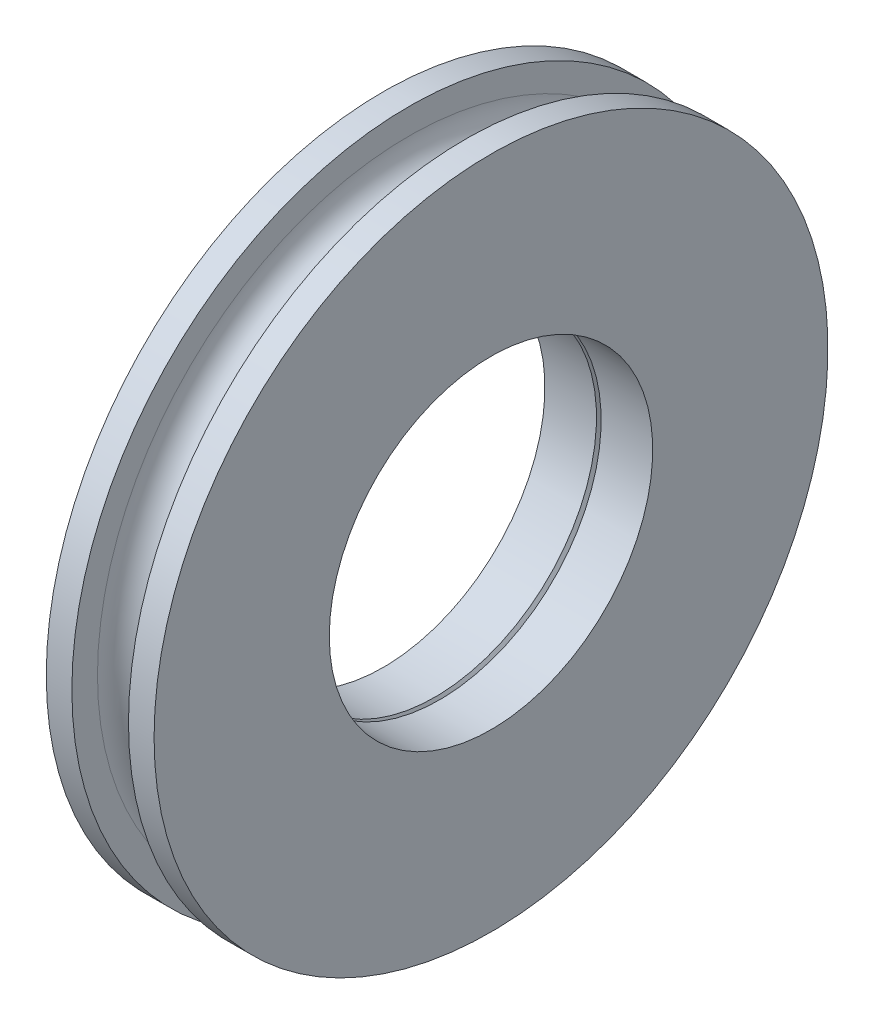
from build123d import *


with BuildPart() as part:
    # Sketch1 → Revolve1 (revolve)
    with BuildSketch(Plane(origin=(0, 0, 0), x_dir=(-1, 0, 0), z_dir=(0, 0, -1)), mode=Mode.PRIVATE) as revolve1_sk:
        with BuildLine():
            Line((4, 25), (2.1, 25))
            Line((2.1, 25), (2.1, 23.1))
            ThreePointArc((2.1, 23.1), (0, 21), (-2.1, 23.1))
            Line((-2.1, 23.1), (-2.1, 25))
            Line((-2.1, 25), (-4, 25))
            Line((-4, 25), (-4, 12))
            Line((-4, 12), (-0.173205081, 12))
            Line((-0.173205081, 12), (0, 12.3))
            Line((0, 12.3), (0.173205081, 12))
            Line((0.173205081, 12), (4, 12))
            Line((4, 12), (4, 25))
        make_face()
    revolve(revolve1_sk.sketch.rotate(Axis((3, 0, 0), (-1, 0, 0)), 270), axis=Axis((3, 0, 0), (-1, 0, 0)))


solid = part.part
